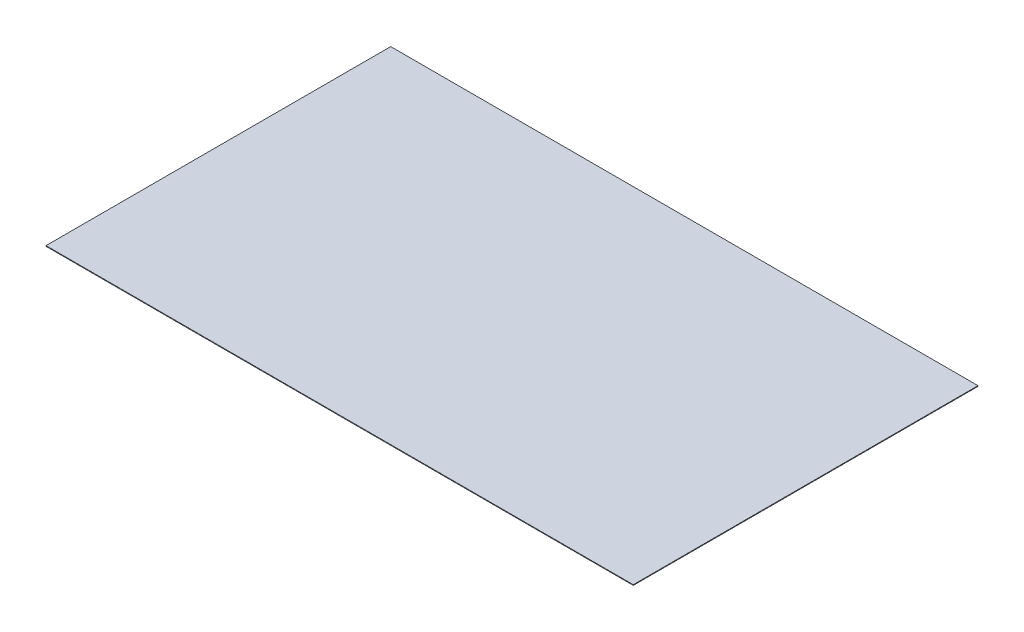
from build123d import *

# Parameters (mm, degrees)
SKETCH1_W             = 1397
SKETCH1_H             = 1.5
STORE_DIS_UST_1_DEPTH = 820


with BuildPart() as part:
    # Sketch1 → STORE_dis_ust_1 (new body)
    with BuildSketch(Plane.XY):
        with Locations((700, 1969.25)):
            Rectangle(SKETCH1_W, SKETCH1_H)
    extrude(amount=-STORE_DIS_UST_1_DEPTH)


solid = part.part
